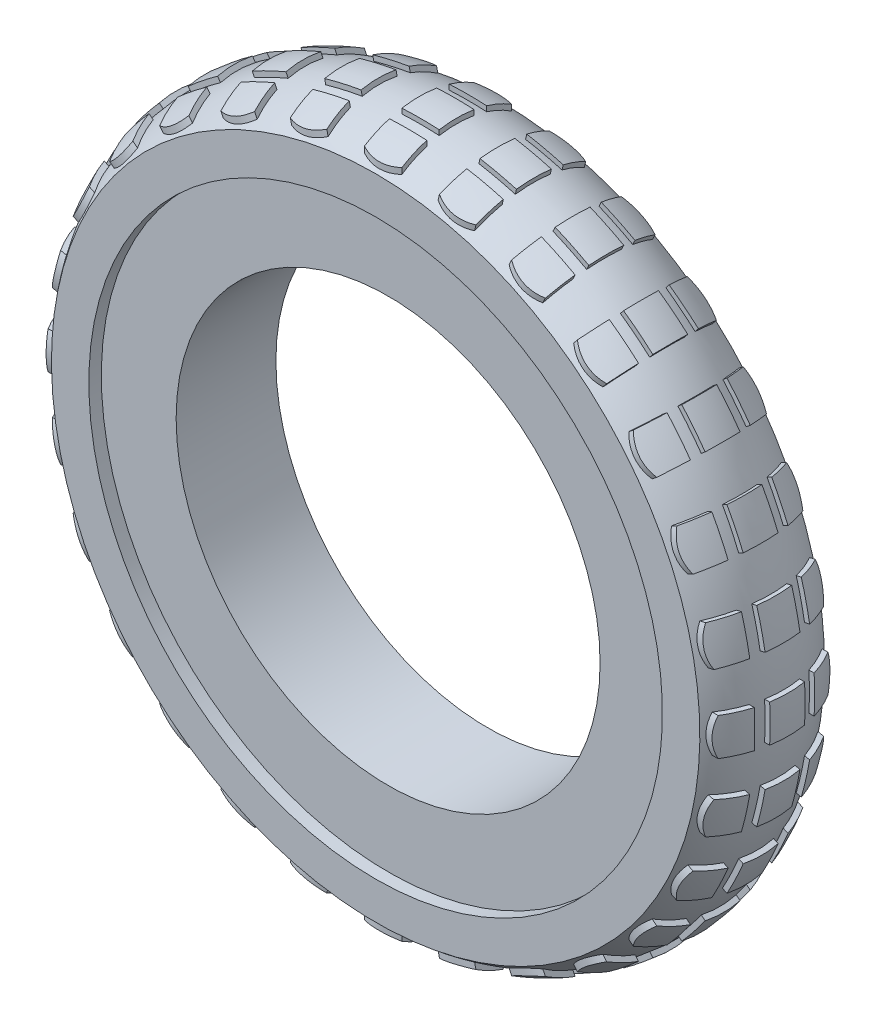
from build123d import *
from build123d.topology import SkipClean

# Parameters (mm, degrees)
SKETCH_1_R                 = 11.5
SKETCH_1_R_2               = 8.5
EXTRUDE_1_DEPTH            = 4
SKETCH_3_W                 = 5
SKETCH_3_H                 = 1.5
EXTRUDE_2_REACH            = 34.135
EXTRUDE_2_END_MAJOR_RADIUS = 9.877501001
EXTRUDE_2_END_MINOR_RADIUS = 4.2
EXTRUDE_START              = 12
SKETCH_4_W                 = 1.5
SKETCH_4_H                 = 1.4
PATTERN_CIRCULAR_1_COUNT   = 28


with BuildPart() as part:
    # 草圖1 → 填料-伸長1 (new body)
    with BuildSketch(Plane.XY):
        Circle(SKETCH_1_R)
        Circle(SKETCH_1_R_2, mode=Mode.SUBTRACT)
    extrude(amount=EXTRUDE_1_DEPTH)

    # 草圖3 → 旋轉1 (revolve)
    with BuildSketch(Plane(origin=(0, 0, 0), x_dir=(0, 0, -1), z_dir=(1, 0, 0))):
        with Locations((-2, 12.25)):
            Rectangle(SKETCH_3_W, SKETCH_3_H)
        with BuildLine():
            ThreePointArc((-4.5, 13), (-2, 13.877501001), (0.5, 13))
            Line((0.5, 13), (-4.5, 13))
        make_face()
    revolve(axis=Axis((0, 0, 0), (0, 0, 1)))

    # 填料-伸長2: up to this torus (the profile starts inside it)
    extrude_2_end = Plane(origin=(0, 0, 2), z_dir=(0, 0, -1)) * Torus(EXTRUDE_2_END_MAJOR_RADIUS, EXTRUDE_2_END_MINOR_RADIUS, mode=Mode.PRIVATE)
    # 草圖4 → 填料-伸長2 (add, up to the surface)
    with BuildSketch(Plane(origin=(0, 0, 0), x_dir=(1, 0, 0), z_dir=(0, 1, 0)).offset(EXTRUDE_START), mode=Mode.PRIVATE) as extrude_2_sk1:
        with Locations((0, -2)):
            Rectangle(SKETCH_4_W, SKETCH_4_H)
    extrude_2_tool1 = extrude(extrude_2_sk1.sketch, amount=EXTRUDE_2_REACH, mode=Mode.PRIVATE) & extrude_2_end
    # 草圖4 → 填料-伸長2 (add, up to the surface)
    with BuildSketch(Plane(origin=(0, 0, 0), x_dir=(1, 0, 0), z_dir=(0, 1, 0)).offset(EXTRUDE_START), mode=Mode.PRIVATE) as extrude_2_sk2:
        with BuildLine():
            Line((-0.75, -0.8), (0.75, -0.8))
            Line((0.75, -0.8), (0.75, 0.2))
            ThreePointArc((0.75, 0.2), (0, 0.363693183), (-0.75, 0.2))
            Line((-0.75, 0.2), (-0.75, -0.8))
        make_face()
    extrude_2_tool2 = extrude(extrude_2_sk2.sketch, amount=EXTRUDE_2_REACH, mode=Mode.PRIVATE) & extrude_2_end
    # 草圖4 → 填料-伸長2 (add, up to the surface)
    with BuildSketch(Plane(origin=(0, 0, 0), x_dir=(1, 0, 0), z_dir=(0, 1, 0)).offset(EXTRUDE_START), mode=Mode.PRIVATE) as extrude_2_sk3:
        with BuildLine():
            Line((0.75, -3.2), (0.75, -4.2))
            ThreePointArc((0.75, -4.2), (0, -4.363693183), (-0.75, -4.2))
            Line((-0.75, -4.2), (-0.75, -3.2))
            Line((-0.75, -3.2), (0.75, -3.2))
        make_face()
    extrude_2_tool3 = extrude(extrude_2_sk3.sketch, amount=EXTRUDE_2_REACH, mode=Mode.PRIVATE) & extrude_2_end
    extrude_2 = extrude_2_tool1.solids().sort_by_distance((0, 12, 2))[0] + extrude_2_tool2.solids().sort_by_distance((0, 12, 0.243862))[0] + extrude_2_tool3.solids().sort_by_distance((0, 12, 3.756138))[0]
    add(extrude_2)

    # 環狀複製排列1: 填料-伸長2 ×28 about axis
    with SkipClean():  # the faces are left unmerged after this step: merging them gives an invalid solid
        pattern_circular_1_axis = Axis((0, 0, 0), (0, 0, 1))
        for i in range(1, PATTERN_CIRCULAR_1_COUNT):
            add(extrude_2.rotate(pattern_circular_1_axis, i * 360 / PATTERN_CIRCULAR_1_COUNT))


solid = part.part
